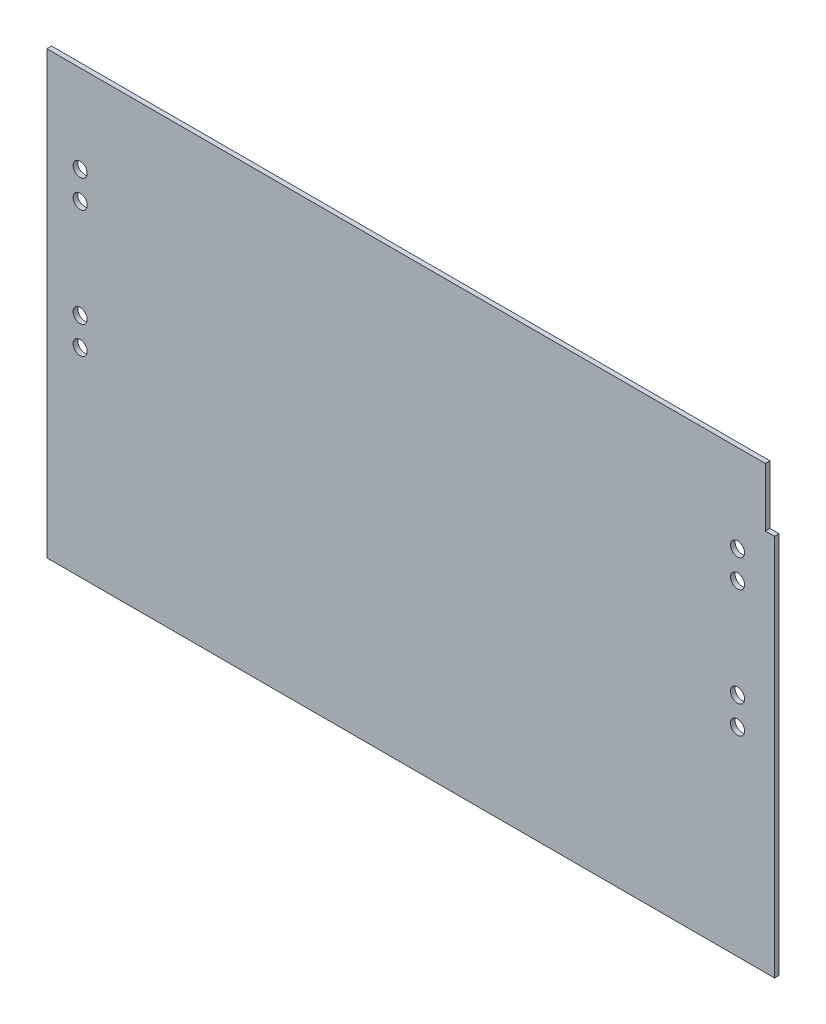
from build123d import *

# Parameters (mm, degrees)
SKETCH1_R           = 4.826
BOSS_EXTRUDE1_DEPTH = 3.175


with BuildPart() as part:
    # Sketch1 → Boss-Extrude1 (new body)
    with BuildSketch(Plane.XY):
        Polygon((-249.8725, -120.9675), (-249.8725, -151.4475), (-211.7725, -151.4475), (211.7725, -151.4475), (249.8725, -151.4475), (249.8725, -120.9675), (249.8725, 111.2647), (243.5225, 111.2647), (243.5225, 151.4475), (-249.8725, 151.4475), align=None)
        with Locations((-227.0125, -14.9225)):
            Circle(SKETCH1_R, mode=Mode.SUBTRACT)
        with Locations((-227.0125, 4.1275)):
            Circle(SKETCH1_R, mode=Mode.SUBTRACT)
        with Locations((-227.0125, 91.1225)):
            Circle(SKETCH1_R, mode=Mode.SUBTRACT)
        with Locations((-227.0125, 72.0725)):
            Circle(SKETCH1_R, mode=Mode.SUBTRACT)
        with Locations((224.4725, -14.9225)):
            Circle(SKETCH1_R, mode=Mode.SUBTRACT)
        with Locations((224.4725, 4.1275)):
            Circle(SKETCH1_R, mode=Mode.SUBTRACT)
        with Locations((224.4725, 91.1225)):
            Circle(SKETCH1_R, mode=Mode.SUBTRACT)
        with Locations((224.4725, 72.0725)):
            Circle(SKETCH1_R, mode=Mode.SUBTRACT)
    extrude(amount=BOSS_EXTRUDE1_DEPTH)


solid = part.part
